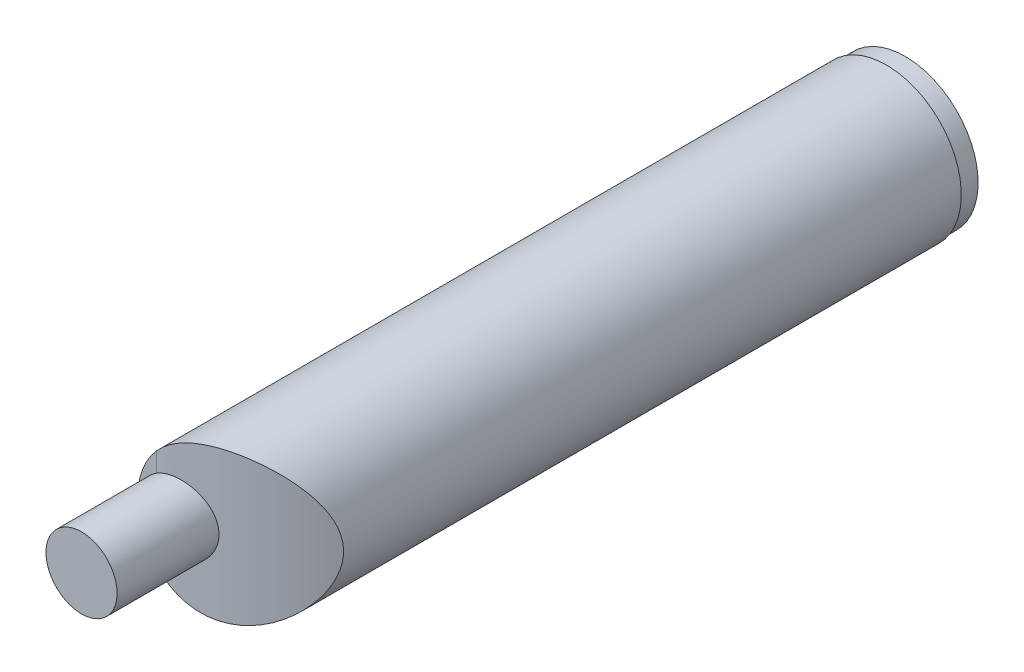
from build123d import *
from build123d.topology import SkipClean

# Parameters (mm, degrees)
SKETCH_1_R                  = 4
EXTRUDE_1_DEPTH             = 37
SKETCH_2_R                  = 4
SKETCH_2_R_2                = 3.9
CUT_EXTRUDE_1_DEPTH         = 1
CUT_EXTRUDE_2_DEPTH         = 38.429934544
CUT_EXTRUDE_2_DEPTH_BACK    = 38.429934544
EXTRUDE_2_REACH             = 39.43
SKETCH_4_R                  = 1.9
EXTRUDE_2_DIRECTION_2_DEPTH = 5


with BuildPart() as part:
    # 草图1 → 凸台-拉伸1 (new body)
    with BuildSketch(Plane.XY):
        Circle(SKETCH_1_R)
    extrude(amount=EXTRUDE_1_DEPTH)

    # 草图2 → 切除-拉伸1 (cut)
    with BuildSketch(Plane(origin=(0, 0, 0), x_dir=(-1, 0, 0), z_dir=(0, 0, -1))):
        Circle(SKETCH_2_R)
        Circle(SKETCH_2_R_2, mode=Mode.SUBTRACT)
    extrude(amount=-CUT_EXTRUDE_1_DEPTH, mode=Mode.SUBTRACT)

    # 草图3 → 切除-拉伸2 (cut, two sides: drawn at the far end of the back side and taken through both)
    with BuildSketch(Plane(origin=(0, 0, 0), x_dir=(1, 0, 0), z_dir=(0, 1, 0)).offset(-CUT_EXTRUDE_2_DEPTH_BACK)):
        with BuildLine():
            Line((-3, -37), (4, -37))
            Line((4, -37), (4, -34))
            ThreePointArc((4, -34), (0.807886553, -36.218401957), (-3, -37))
        make_face()
    extrude(amount=CUT_EXTRUDE_2_DEPTH + CUT_EXTRUDE_2_DEPTH_BACK, mode=Mode.SUBTRACT)

    # 草图4 → 凸台-拉伸2 (add, up to next)
    with BuildSketch(Plane.XY.offset(37), mode=Mode.PRIVATE) as extrude_2_sk1:
        with Locations((-2, 0)):
            Circle(SKETCH_4_R)
    extrude_2_tool1 = extrude(extrude_2_sk1.sketch, amount=-EXTRUDE_2_REACH, mode=Mode.PRIVATE) - part.part
    add(extrude_2_tool1.solids().sort_by_distance((-2, 0, 37))[0])

    # 草图4 → 凸台-拉伸2 direction 2 (add)
    with SkipClean():  # the faces are left unmerged after this step: merging them gives an invalid solid
        with BuildSketch(Plane.XY.offset(37)):
            with Locations((-2, 0)):
                Circle(SKETCH_4_R)
        extrude(amount=EXTRUDE_2_DIRECTION_2_DEPTH)
    add(part.part.scale(1), mode=Mode.REPLACE)  # the faces are merged on a copy

    # 草图5 → 切除-旋转3 (revolve, cut)
    with BuildSketch(Plane(origin=(0, 0, 0), x_dir=(0, 0, -1), z_dir=(1, 0, 0))):
        with BuildLine():
            Line((0, 3.5), (0.5, 3.5))
            Line((0.5, 3.5), (0.5, 0))
            Line((0.5, 0), (0, 0))
            ThreePointArc((0, 0), (-0.079251839, 1.256485548), (-0.315751187, 2.493055338))
            ThreePointArc((-0.315751187, 2.493055338), (-0.301514199, 3.041568933), (0, 3.5))
        make_face()
    revolve(axis=Axis((0, 0, 10), (0, 0, -1)), mode=Mode.SUBTRACT)


solid = part.part
